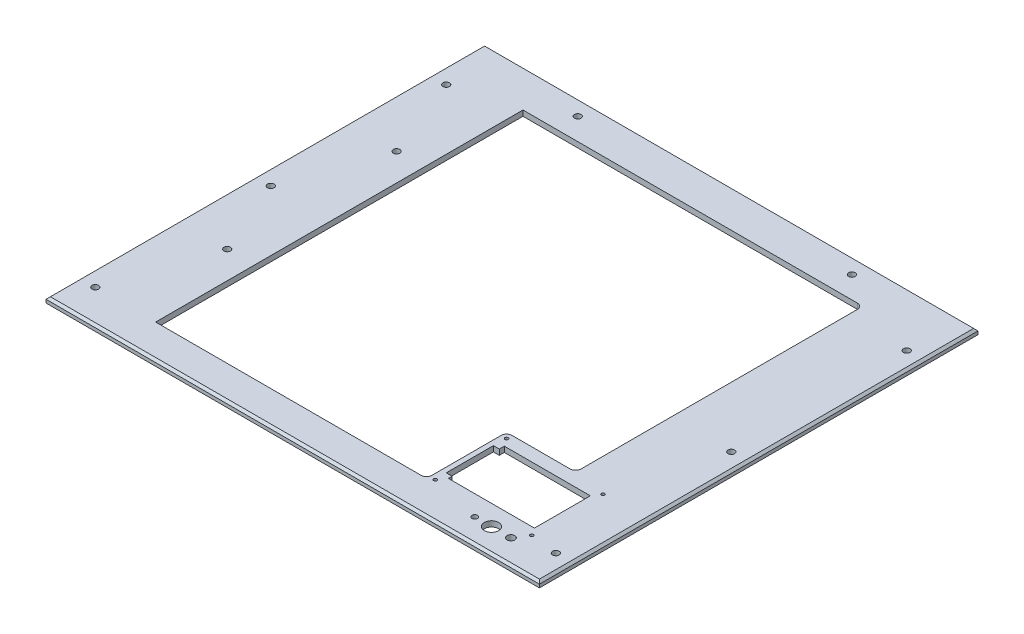
from build123d import *

# Parameters (mm, degrees)
CROQUIS1_R              = 3
CROQUIS1_R_2            = 1.5
CROQUIS1_R_3            = 6.5
CROQUIS1_R_4            = 3.5
CROQUIS1_R_5            = 2.5
SALIENTE_EXTRUIR1_DEPTH = 5
CHAFL_N1_SIZE           = 2
REDONDEO1_R             = 5


with BuildPart() as part:
    # Croquis1 → Saliente-Extruir1 (new body)
    with BuildSketch(Plane(origin=(0, 0, 0), x_dir=(1, 0, 0), z_dir=(0, 1, 0))):
        Polygon((191.673151751, -229.571984436), (261.673151751, -229.571984436), (261.673151751, 170.428015564), (-188.326848249, 170.428015564), (-188.326848249, -229.571984436), (-118.326848249, -229.571984436), align=None)
        with Locations(Location((-173.326848249, 120.428015564, 0), (0, 0, 270))):
            Circle(CROQUIS1_R, mode=Mode.SUBTRACT)
        with Locations(Location((-173.326848249, -199.571984436, 0), (0, 0, 270))):
            Circle(CROQUIS1_R, mode=Mode.SUBTRACT)
        with Locations(Location((246.673151751, -199.571984436, 0), (0, 0, 270))):
            Circle(CROQUIS1_R, mode=Mode.SUBTRACT)
        with Locations(Location((246.673151751, 120.428015564, 0), (0, 0, 270))):
            Circle(CROQUIS1_R, mode=Mode.SUBTRACT)
        with Locations(Location((-173.326848249, -39.571984436, 0), (0, 0, 270))):
            Circle(CROQUIS1_R, mode=Mode.SUBTRACT)
        with Locations(Location((246.673151751, -39.571984436, 0), (0, 0, 270))):
            Circle(CROQUIS1_R, mode=Mode.SUBTRACT)
        with Locations(Location((-88.326848249, 155.428015564, 0), (0, 0, 270))):
            Circle(CROQUIS1_R, mode=Mode.SUBTRACT)
        with Locations(Location((161.673151751, 155.428015564, 0), (0, 0, 270))):
            Circle(CROQUIS1_R, mode=Mode.SUBTRACT)
        with Locations(Location((133.723151751, -131.571984436, 0), (0, 0, 270))):
            Circle(CROQUIS1_R_2, mode=Mode.SUBTRACT)
        with Locations(Location((133.723151751, -196.571984436, 0), (0, 0, 270))):
            Circle(CROQUIS1_R_2, mode=Mode.SUBTRACT)
        with Locations(Location((221.673151751, -196.571984436, 0), (0, 0, 270))):
            Circle(CROQUIS1_R_2, mode=Mode.SUBTRACT)
        with Locations(Location((221.673151751, -131.571984436, 0), (0, 0, 270))):
            Circle(CROQUIS1_R_2, mode=Mode.SUBTRACT)
        with Locations(Location((196.323151751, -207.921984436, 0), (0, 0, 270))):
            Circle(CROQUIS1_R_3, mode=Mode.SUBTRACT)
        with Locations(Location((214.073151751, -207.921984436, 0), (0, 0, 270))):
            Circle(CROQUIS1_R_4, mode=Mode.SUBTRACT)
        with Locations(Location((181.073151751, -207.921984436, 0), (0, 0, 270))):
            Circle(CROQUIS1_R_5, mode=Mode.SUBTRACT)
        with Locations(Location((-143.326848249, 45.178015564, 0), (0, 0, 270))):
            Circle(CROQUIS1_R, mode=Mode.SUBTRACT)
        with Locations(Location((-143.326848249, -109.321984436, 0), (0, 0, 270))):
            Circle(CROQUIS1_R, mode=Mode.SUBTRACT)
        Polygon((138.673151751, -186.171984436), (138.673151751, -189.571984436), (217.123151751, -189.571984436), (217.123151751, -138.571984436), (138.673151751, -138.571984436), (138.673151751, -143.171984436), (133.273151751, -143.171984436), (133.273151751, -186.171984436), align=None, mode=Mode.SUBTRACT)
        Polygon((-118.326848249, -199.571984436), (-118.326848249, 135.428015564), (191.673151751, 135.428015564), (191.673151751, -126.571984436), (128.723151751, -126.571984436), (128.723151751, -199.571984436), align=None, mode=Mode.SUBTRACT)
    extrude(amount=SALIENTE_EXTRUIR1_DEPTH)

    # Chaflán1
    chafl_n1_edges = [part.edges().sort_by_distance(p)[0] for p in [
        (261.673151751, 5, 29.571984436),
        (36.673151751, 5, -170.428015564),
        (-188.326848249, 5, 29.571984436),
        (36.673151751, 5, 229.571984436),
    ]]
    chamfer(chafl_n1_edges, length=CHAFL_N1_SIZE)

    # Redondeo1
    redondeo1_edges = [part.edges().sort_by_distance(p)[0] for p in [
        (191.673151751, 2.5, 126.571984436),
        (191.673151751, 2.5, -135.428015564),
        (128.723151751, 2.5, 199.571984436),
        (128.723151751, 2.5, 126.571984436),
    ]]
    fillet(redondeo1_edges, radius=REDONDEO1_R)


solid = part.part
